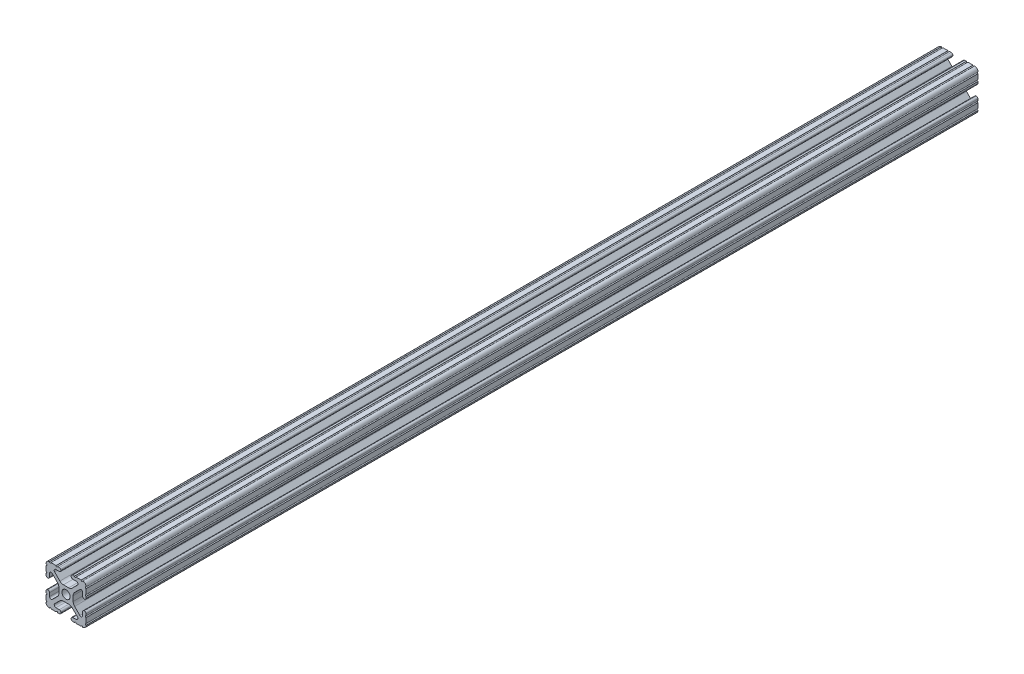
from build123d import *

# Parameters (mm, degrees)
SKETCH1_R           = 2.6035
BOSS_EXTRUDE1_DEPTH = 282.575


with BuildPart() as part:
    # Sketch1 → Boss-Extrude1 (new, symmetric)
    with BuildSketch(Plane.XY):
        with BuildLine():
            Line((-7.179650497, -8.645192506), (-3.952270251, -5.423690499))
            ThreePointArc((-3.952270251, -5.423690499), (-2.922936451, -4.736929036), (-1.709253557, -4.4958))
            Line((-1.709253557, -4.4958), (1.709253557, -4.4958))
            ThreePointArc((1.709253557, -4.4958), (2.922936451, -4.736929036), (3.952270251, -5.423690499))
            Line((3.952270251, -5.423690499), (7.179650497, -8.645192506))
            ThreePointArc((7.179650497, -8.645192506), (7.41473083, -9.822813117), (6.416408329, -10.4902))
            Line((6.416408329, -10.4902), (4.287512407, -10.4902))
            ThreePointArc((4.287512407, -10.4902), (3.54574862, -10.79744862), (3.2385, -11.539212407))
            Line((3.2385, -11.539212407), (3.2385, -11.650987593))
            ThreePointArc((3.2385, -11.650987593), (3.54574862, -12.39275138), (4.287512407, -12.7))
            Line((4.287512407, -12.7), (5.317126718, -12.7))
            ThreePointArc((5.317126718, -12.7), (5.825126718, -12.192), (6.333126718, -12.7))
            Line((6.333126718, -12.7), (9.550443118, -12.7))
            ThreePointArc((9.550443118, -12.7), (10.058366869, -12.192000006), (10.566443095, -12.699847501))
            ThreePointArc((10.566443095, -12.699847501), (12.082537762, -12.08250727), (12.699846982, -10.566399977))
            ThreePointArc((12.699846982, -10.566399977), (12.192000006, -10.058323491), (12.7, -9.5504))
            Line((12.7, -9.5504), (12.7, -6.3330836))
            ThreePointArc((12.7, -6.3330836), (12.192, -5.8250836), (12.7, -5.3170836))
            Line((12.7, -5.3170836), (12.7, -4.287469289))
            ThreePointArc((12.7, -4.287469289), (12.39275138, -3.545705502), (11.650987593, -3.238456882))
            Line((11.650987593, -3.238456882), (11.539212407, -3.238456882))
            ThreePointArc((11.539212407, -3.238456882), (10.79744862, -3.545705502), (10.4902, -4.287469289))
            Line((10.4902, -4.287469289), (10.4902, -6.402089023))
            ThreePointArc((10.4902, -6.402089023), (9.856505071, -7.351067942), (8.737131347, -7.129408934))
            Line((8.737131347, -7.129408934), (5.441005833, -3.840816462))
            ThreePointArc((5.441005833, -3.840816462), (4.750877967, -2.809883091), (4.5085, -1.593185507))
            Line((4.5085, -1.593185507), (4.5085, 1.593185507))
            ThreePointArc((4.5085, 1.593185507), (4.750877967, 2.809883091), (5.441005833, 3.840816462))
            Line((5.441005833, 3.840816462), (8.737131347, 7.129408934))
            ThreePointArc((8.737131347, 7.129408934), (9.856505071, 7.351067942), (10.4902, 6.402089023))
            Line((10.4902, 6.402089023), (10.4902, 4.287469289))
            ThreePointArc((10.4902, 4.287469289), (10.79744862, 3.545705502), (11.539212407, 3.238456882))
            Line((11.539212407, 3.238456882), (11.650987593, 3.238456882))
            ThreePointArc((11.650987593, 3.238456882), (12.39275138, 3.545705502), (12.7, 4.287469289))
            Line((12.7, 4.287469289), (12.7, 5.3170836))
            ThreePointArc((12.7, 5.3170836), (12.192, 5.8250836), (12.7, 6.3330836))
            Line((12.7, 6.3330836), (12.7, 9.5504))
            ThreePointArc((12.7, 9.5504), (12.192000006, 10.058323491), (12.699846982, 10.566399977))
            ThreePointArc((12.699846982, 10.566399977), (12.082537762, 12.08250727), (10.566443095, 12.699847501))
            ThreePointArc((10.566443095, 12.699847501), (10.058366869, 12.192000006), (9.550443118, 12.7))
            Line((9.550443118, 12.7), (6.333126718, 12.7))
            ThreePointArc((6.333126718, 12.7), (5.825126718, 12.192), (5.317126718, 12.7))
            Line((5.317126718, 12.7), (4.287512407, 12.7))
            ThreePointArc((4.287512407, 12.7), (3.54574862, 12.39275138), (3.2385, 11.650987593))
            Line((3.2385, 11.650987593), (3.2385, 11.539212407))
            ThreePointArc((3.2385, 11.539212407), (3.54574862, 10.79744862), (4.287512407, 10.4902))
            Line((4.287512407, 10.4902), (6.476788598, 10.4902))
            ThreePointArc((6.476788598, 10.4902), (7.432222385, 9.85140422), (7.207036008, 8.724370562))
            Line((7.207036008, 8.724370562), (3.898272566, 5.423169045))
            ThreePointArc((3.898272566, 5.423169045), (2.869120213, 4.736787962), (1.655778399, 4.4958))
            Line((1.655778399, 4.4958), (-1.655778399, 4.4958))
            ThreePointArc((-1.655778399, 4.4958), (-2.869120213, 4.736787962), (-3.898272566, 5.423169045))
            Line((-3.898272566, 5.423169045), (-7.207036008, 8.724370562))
            ThreePointArc((-7.207036008, 8.724370562), (-7.432222385, 9.85140422), (-6.476788598, 10.4902))
            Line((-6.476788598, 10.4902), (-4.287512407, 10.4902))
            ThreePointArc((-4.287512407, 10.4902), (-3.54574862, 10.79744862), (-3.2385, 11.539212407))
            Line((-3.2385, 11.539212407), (-3.2385, 11.650987593))
            ThreePointArc((-3.2385, 11.650987593), (-3.54574862, 12.39275138), (-4.287512407, 12.7))
            Line((-4.287512407, 12.7), (-5.317126718, 12.7))
            ThreePointArc((-5.317126718, 12.7), (-5.825126718, 12.192), (-6.333126718, 12.7))
            Line((-6.333126718, 12.7), (-9.550443118, 12.7))
            ThreePointArc((-9.550443118, 12.7), (-10.058366869, 12.192000006), (-10.566443095, 12.699847501))
            ThreePointArc((-10.566443095, 12.699847501), (-12.082537762, 12.08250727), (-12.699846982, 10.566399977))
            ThreePointArc((-12.699846982, 10.566399977), (-12.192000006, 10.058323491), (-12.7, 9.5504))
            Line((-12.7, 9.5504), (-12.7, 6.3330836))
            ThreePointArc((-12.7, 6.3330836), (-12.192, 5.8250836), (-12.7, 5.3170836))
            Line((-12.7, 5.3170836), (-12.7, 4.287469289))
            ThreePointArc((-12.7, 4.287469289), (-12.39275138, 3.545705502), (-11.650987593, 3.238456882))
            Line((-11.650987593, 3.238456882), (-11.539212407, 3.238456882))
            ThreePointArc((-11.539212407, 3.238456882), (-10.79744862, 3.545705502), (-10.4902, 4.287469289))
            Line((-10.4902, 4.287469289), (-10.4902, 6.402089023))
            ThreePointArc((-10.4902, 6.402089023), (-9.856505071, 7.351067942), (-8.737131347, 7.129408934))
            Line((-8.737131347, 7.129408934), (-5.441005833, 3.840816462))
            ThreePointArc((-5.441005833, 3.840816462), (-4.750877967, 2.809883091), (-4.5085, 1.593185507))
            Line((-4.5085, 1.593185507), (-4.5085, -1.593185507))
            ThreePointArc((-4.5085, -1.593185507), (-4.750877967, -2.809883091), (-5.441005833, -3.840816462))
            Line((-5.441005833, -3.840816462), (-8.737131347, -7.129408934))
            ThreePointArc((-8.737131347, -7.129408934), (-9.856505071, -7.351067942), (-10.4902, -6.402089023))
            Line((-10.4902, -6.402089023), (-10.4902, -4.287469289))
            ThreePointArc((-10.4902, -4.287469289), (-10.79744862, -3.545705502), (-11.539212407, -3.238456882))
            Line((-11.539212407, -3.238456882), (-11.650987593, -3.238456882))
            ThreePointArc((-11.650987593, -3.238456882), (-12.39275138, -3.545705502), (-12.7, -4.287469289))
            Line((-12.7, -4.287469289), (-12.7, -5.3170836))
            ThreePointArc((-12.7, -5.3170836), (-12.192, -5.8250836), (-12.7, -6.3330836))
            Line((-12.7, -6.3330836), (-12.7, -9.5504))
            ThreePointArc((-12.7, -9.5504), (-12.192000006, -10.058323491), (-12.699846982, -10.566399977))
            ThreePointArc((-12.699846982, -10.566399977), (-12.082537762, -12.08250727), (-10.566443095, -12.699847501))
            ThreePointArc((-10.566443095, -12.699847501), (-10.058366869, -12.192000006), (-9.550443118, -12.7))
            Line((-9.550443118, -12.7), (-6.333126718, -12.7))
            ThreePointArc((-6.333126718, -12.7), (-5.825126718, -12.192), (-5.317126718, -12.7))
            Line((-5.317126718, -12.7), (-4.287512407, -12.7))
            ThreePointArc((-4.287512407, -12.7), (-3.54574862, -12.39275138), (-3.2385, -11.650987593))
            Line((-3.2385, -11.650987593), (-3.2385, -11.539212407))
            ThreePointArc((-3.2385, -11.539212407), (-3.54574862, -10.79744862), (-4.287512407, -10.4902))
            Line((-4.287512407, -10.4902), (-6.416408329, -10.4902))
            ThreePointArc((-6.416408329, -10.4902), (-7.41473083, -9.822813117), (-7.179650497, -8.645192506))
        make_face()
        Circle(SKETCH1_R, mode=Mode.SUBTRACT)
    extrude(amount=BOSS_EXTRUDE1_DEPTH, both=True)


solid = part.part
